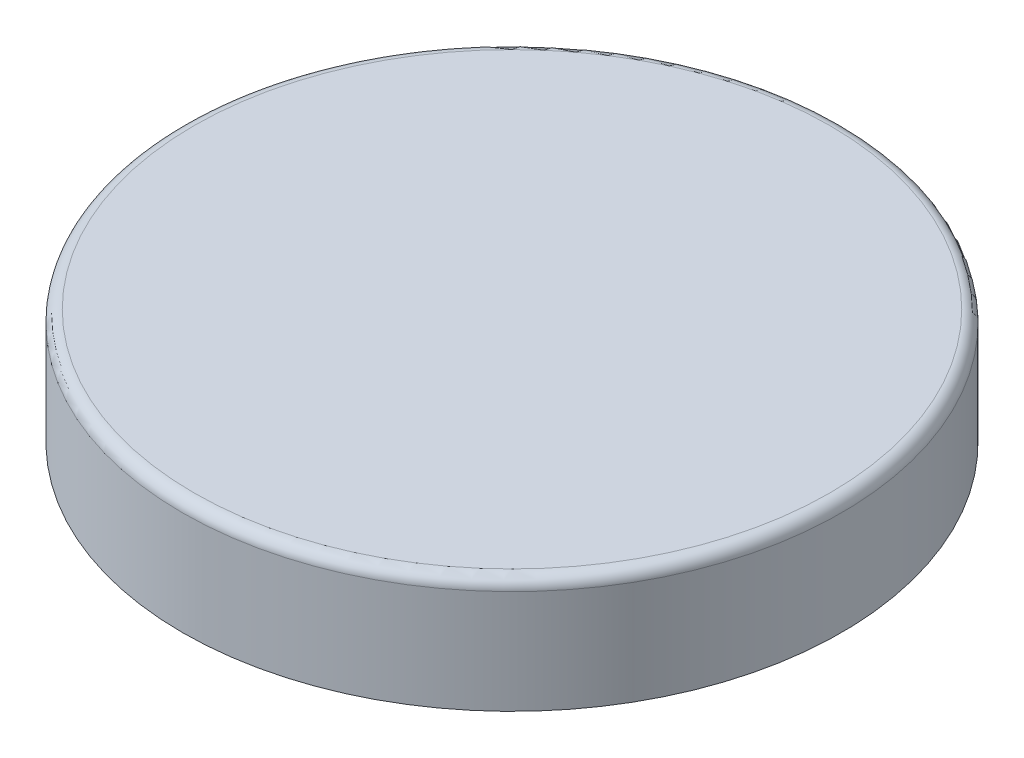
from build123d import *

# Parameters (mm, degrees)
ESQUISSE1_R        = 14.3
BOSS_EXTRU_1_DEPTH = 5
COQUE1_T           = -0.5
CONG_1_R           = 0.5


with BuildPart() as part:
    # Esquisse1 → Boss.-Extru.1 (new body)
    with BuildSketch(Plane(origin=(0, 0, 0), x_dir=(1, 0, 0), z_dir=(0, 1, 0))):
        with Locations(Location((0, 0, 0), (0, 0, 270))):
            Circle(ESQUISSE1_R)
    extrude(amount=BOSS_EXTRU_1_DEPTH)

    # Coque1
    coque1_openings = [part.faces().sort_by_distance(p)[0] for p in [
        (0, 0, 0),
    ]]
    offset(amount=COQUE1_T, openings=coque1_openings, kind=Kind.INTERSECTION)

    # Congé1
    cong_1_edges = [part.edges().sort_by_distance(p)[0] for p in [
        (0, 5, -14.3),
    ]]
    fillet(cong_1_edges, radius=CONG_1_R)


solid = part.part
